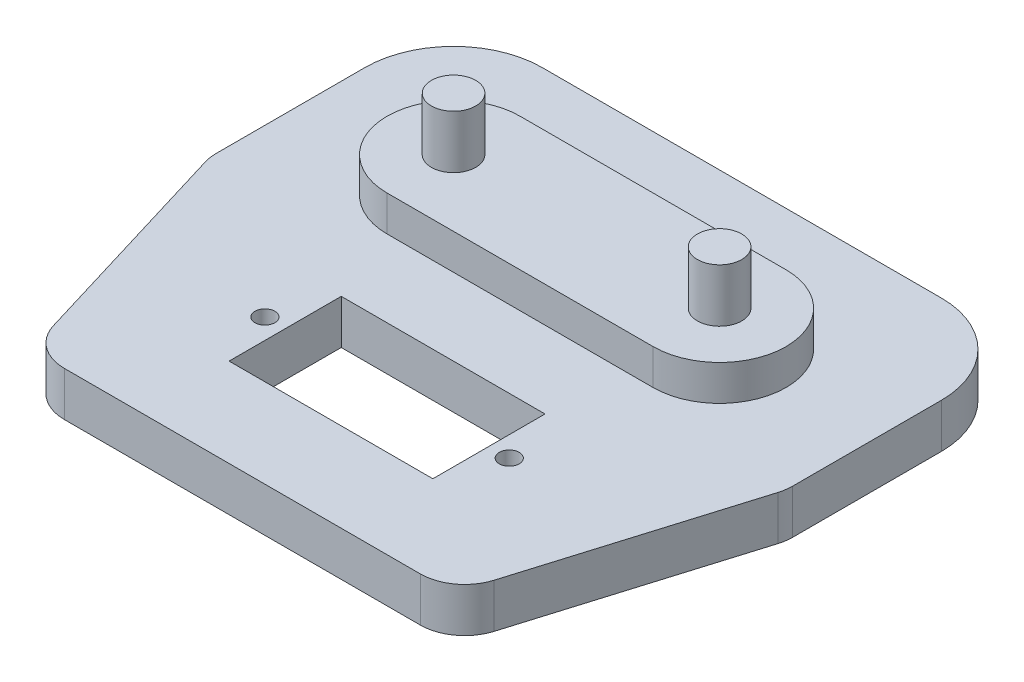
from build123d import *

# Parameters (mm, degrees)
SKETCH1_R           = 1.125
SKETCH1_W           = 22.98
SKETCH1_H           = 12.65
BOSS_EXTRUDE1_DEPTH = 5
SKETCH1_3_R         = 2.5
BOSS_EXTRUDE2_DEPTH = 9
SKETCH1_4_R         = 2.5
BOSS_EXTRUDE3_DEPTH = 15


with BuildPart() as part:
    # Sketch1 → Boss-Extrude1 (new body)
    with BuildSketch(Plane(origin=(0, 0, 0), x_dir=(1, 0, 0), z_dir=(0, 1, 0))):
        with BuildLine():
            Line((-32.5, 18.1625), (-32.5, 1.402234115))
            ThreePointArc((-32.5, 1.402234115), (-32.446161571, 0.670465224), (-32.285805716, -0.045544752))
            Line((-32.285805716, -0.045544752), (-24.854600808, -24.610278867))
            ThreePointArc((-24.854600808, -24.610278867), (-23.048820734, -27.177403133), (-20.068795092, -28.1625))
            Line((-20.068795092, -28.1625), (20.068795092, -28.1625))
            ThreePointArc((20.068795092, -28.1625), (23.048820734, -27.177403133), (24.854600808, -24.610278867))
            Line((24.854600808, -24.610278867), (32.285805716, -0.045544752))
            ThreePointArc((32.285805716, -0.045544752), (32.446161571, 0.670465224), (32.5, 1.402234115))
            Line((32.5, 1.402234115), (32.5, 18.1625))
            ThreePointArc((32.5, 18.1625), (29.571067812, 25.233567812), (22.5, 28.1625))
            Line((22.5, 28.1625), (-22.5, 28.1625))
            ThreePointArc((-22.5, 28.1625), (-29.571067812, 25.233567812), (-32.5, 18.1625))
        make_face()
        with Locations((-13.78, -11.8375)):
            Circle(SKETCH1_R, mode=Mode.SUBTRACT)
        with Locations((0, -11.8375)):
            Rectangle(SKETCH1_W, SKETCH1_H, mode=Mode.SUBTRACT)
        with Locations((13.78, -11.8375)):
            Circle(SKETCH1_R, mode=Mode.SUBTRACT)
        with BuildLine():
            Line((-15, 18.1625), (15, 18.1625))
            ThreePointArc((15, 18.1625), (22.5, 10.6625), (15, 3.1625))
            Line((15, 3.1625), (-15, 3.1625))
            ThreePointArc((-15, 3.1625), (-22.5, 10.6625), (-15, 18.1625))
        make_face(mode=Mode.SUBTRACT)
    extrude(amount=BOSS_EXTRUDE1_DEPTH)

    # Sketch1<3> → Boss-Extrude2 (add)
    with BuildSketch(Plane(origin=(0, 0, 0), x_dir=(1, 0, 0), z_dir=(0, 1, 0))):
        with BuildLine():
            ThreePointArc((15, 3.1625), (22.5, 10.6625), (15, 18.1625))
            Line((15, 18.1625), (-15, 18.1625))
            ThreePointArc((-15, 18.1625), (-22.5, 10.6625), (-15, 3.1625))
            Line((-15, 3.1625), (15, 3.1625))
        make_face()
        with Locations((-15, 10.6625)):
            Circle(SKETCH1_3_R, mode=Mode.SUBTRACT)
        with Locations((15, 10.6625)):
            Circle(SKETCH1_3_R, mode=Mode.SUBTRACT)
    extrude(amount=BOSS_EXTRUDE2_DEPTH)

    # Sketch1<4> → Boss-Extrude3 (add)
    with BuildSketch(Plane(origin=(0, 0, 0), x_dir=(1, 0, 0), z_dir=(0, 1, 0))):
        with Locations((-15, 10.6625)):
            Circle(SKETCH1_4_R)
        with Locations((15, 10.6625)):
            Circle(SKETCH1_4_R)
    extrude(amount=BOSS_EXTRUDE3_DEPTH)


solid = part.part
